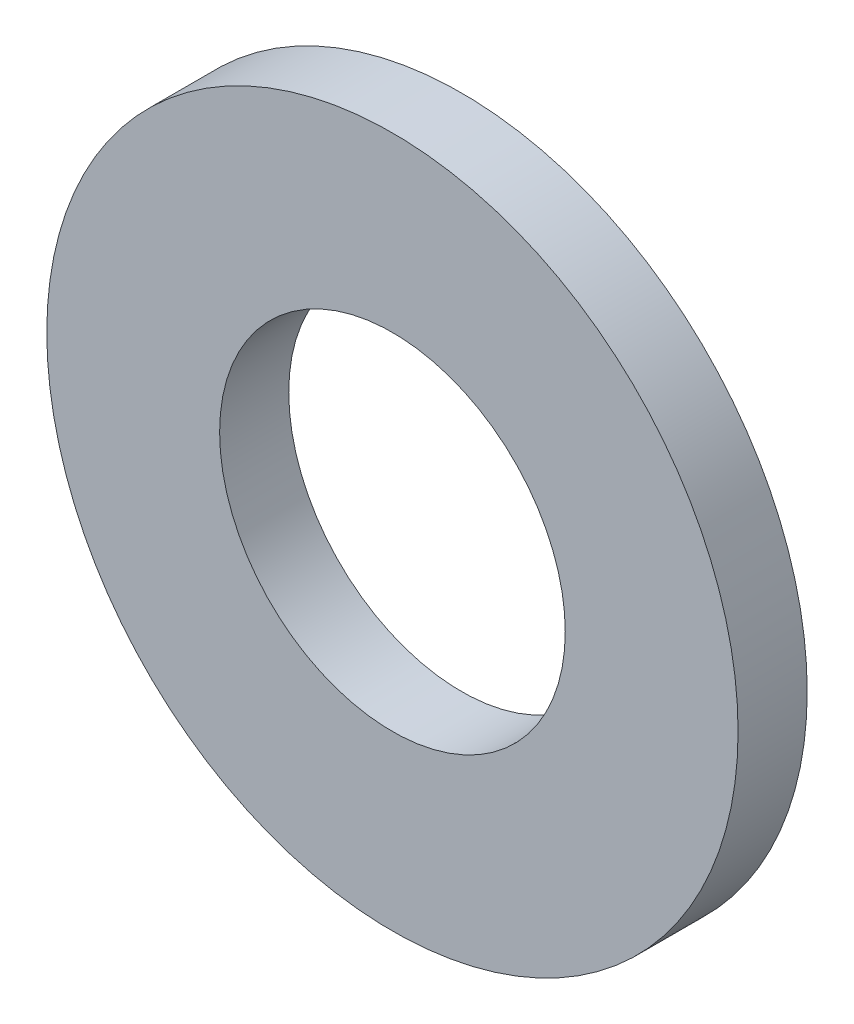
from build123d import *

# Parameters (mm, degrees)
SKETCH1_R           = 2.5
SKETCH1_R_2         = 1.25
BOSS_EXTRUDE1_DEPTH = 0.5


with BuildPart() as part:
    # Sketch1 → Boss-Extrude1 (new body)
    with BuildSketch(Plane.XY):
        Circle(SKETCH1_R)
        Circle(SKETCH1_R_2, mode=Mode.SUBTRACT)
    extrude(amount=BOSS_EXTRUDE1_DEPTH)


solid = part.part
